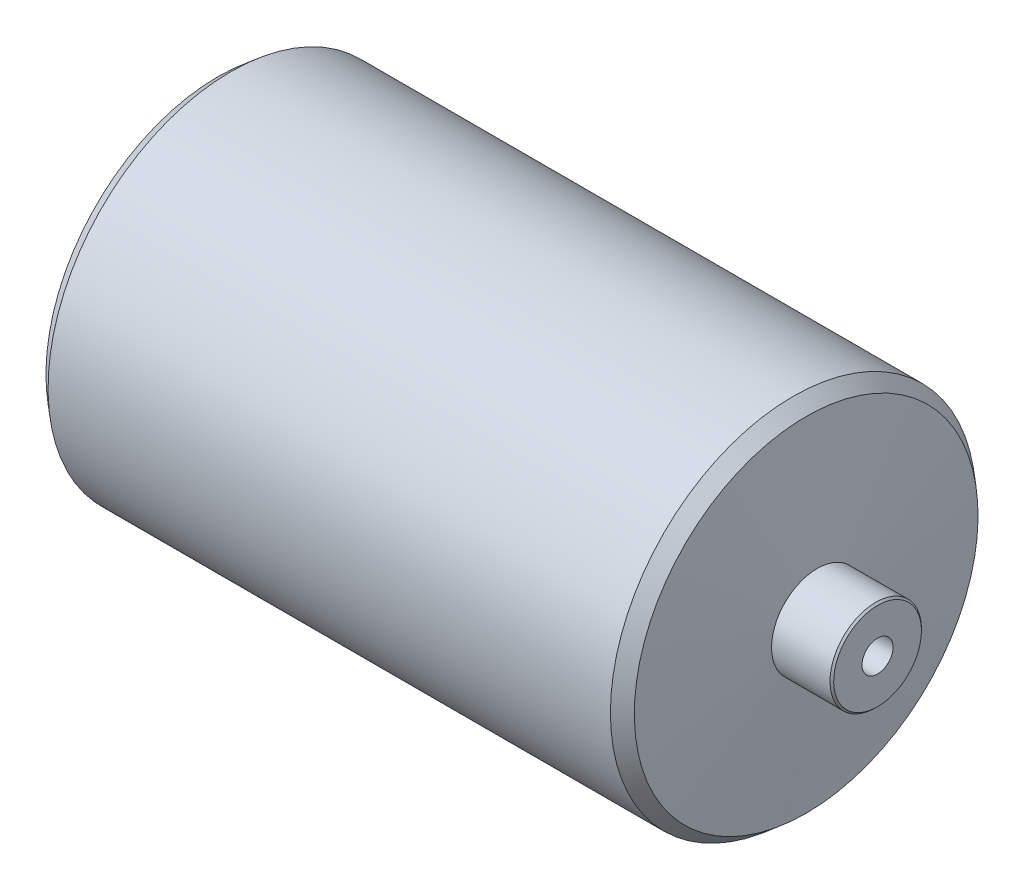
from build123d import *

# Parameters (mm, degrees)
TALADRO_ROSCADO_M102_D     = 8.5
TALADRO_ROSCADO_M102_DEPTH = 56.446342369
TALADRO_ROSCADO_M102_TIP   = 2.553657631


with BuildPart() as part:
    # Croquis1 → Revolución1 (revolve)
    with BuildSketch(Plane.XY):
        Polygon((0, 0), (0, 12), (0.5, 12.5), (16.5, 12.5), (19.519357654, 47.011415906), (23.081013485, 50), (176.918986515, 50), (180.480642346, 47.011415906), (183.5, 12.5), (199.5, 12.5), (200, 12), (200, 0), align=None)
    revolve(axis=Axis((200, 0, 0), (-1, 0, 0)))

    # Croquis4 → Taladro roscado M101 (revolve, cut)
    with BuildSketch(Plane(origin=(200, 0, 0), x_dir=(0, 0, -1), z_dir=(0, 1, 0))):
        Polygon((0, 0), (0, 59), (4.25, 56.446342369), (4.25, 0), align=None)
    revolve(axis=Axis((206.35, 0, 0), (-1, 0, 0)), mode=Mode.SUBTRACT)

    # Taladro roscado M102
    with Locations(Plane(origin=(0, 0, 0), x_dir=(0, -1, 0), z_dir=(-1, 0, 0))):
        with Locations((0, 0)):
            Hole(TALADRO_ROSCADO_M102_D / 2, depth=TALADRO_ROSCADO_M102_DEPTH)
            with Locations((0, 0, -(TALADRO_ROSCADO_M102_DEPTH + TALADRO_ROSCADO_M102_TIP / 2))):  # 118° drill point
                Cone(0, TALADRO_ROSCADO_M102_D / 2, TALADRO_ROSCADO_M102_TIP, mode=Mode.SUBTRACT)


solid = part.part
